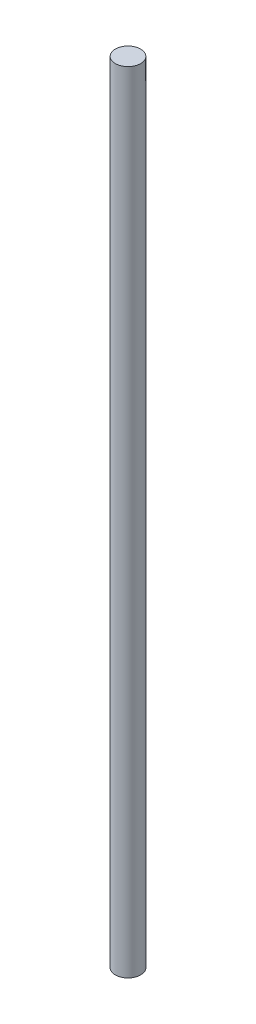
from build123d import *

# Parameters (mm, degrees)
ESQUISSE1_W = 8
ESQUISSE1_H = 500


with BuildPart() as part:
    # Esquisse1 → Révol.-Mince2 (revolve)
    with BuildSketch(Plane.XY, mode=Mode.PRIVATE) as r_vol_mince2_sk:
        with Locations((4, 6.205882353)):
            Rectangle(ESQUISSE1_W, ESQUISSE1_H)
    revolve(r_vol_mince2_sk.sketch.rotate(Axis((0, 256.205882353, 0), (0, -1, 0)), 180), axis=Axis((0, 256.205882353, 0), (0, -1, 0)))


solid = part.part
